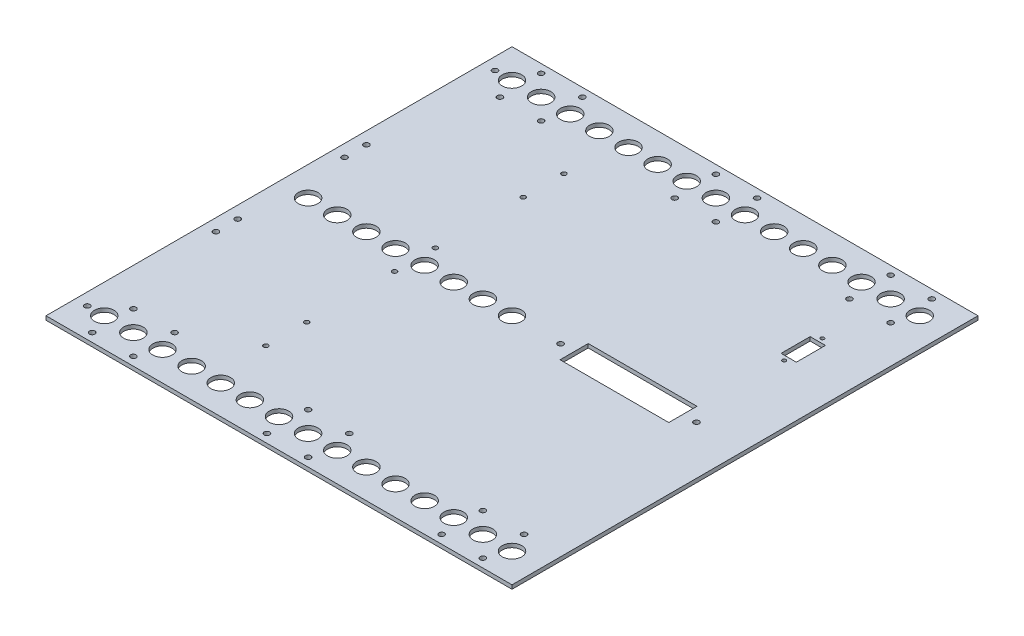
from build123d import *

# Parameters (mm, degrees)
SKETCH1_W           = 304.8
SKETCH1_H           = 304.8
SKETCH1_R           = 6.3627
SKETCH1_R_2         = 1.778
SKETCH1_R_3         = 1.524
SKETCH1_R_4         = 1.190625
SKETCH1_W_2         = 10.0000054
SKETCH1_H_2         = 18.9999874
SKETCH1_W_3         = 71.12
SKETCH1_H_3         = 18.415
BOSS_EXTRUDE1_DEPTH = 2.54


with BuildPart() as part:
    # Sketch1 → Boss-Extrude1 (new body)
    with BuildSketch(Plane(origin=(0, 0, 0), x_dir=(1, 0, 0), z_dir=(0, 1, 0))):
        Rectangle(SKETCH1_W, SKETCH1_H)
        with Locations(Location((-133.35, 133.35, 0), (0, 0, 270))):
            Circle(SKETCH1_R, mode=Mode.SUBTRACT)
        with Locations(Location((-114.3, 133.35, 0), (0, 0, 270))):
            Circle(SKETCH1_R, mode=Mode.SUBTRACT)
        with Locations(Location((-95.25, 133.35, 0), (0, 0, 270))):
            Circle(SKETCH1_R, mode=Mode.SUBTRACT)
        with Locations(Location((-76.2, 133.35, 0), (0, 0, 270))):
            Circle(SKETCH1_R, mode=Mode.SUBTRACT)
        with Locations(Location((-57.15, 133.35, 0), (0, 0, 270))):
            Circle(SKETCH1_R, mode=Mode.SUBTRACT)
        with Locations(Location((-38.1, 133.35, 0), (0, 0, 270))):
            Circle(SKETCH1_R, mode=Mode.SUBTRACT)
        with Locations(Location((-19.05, 133.35, 0), (0, 0, 270))):
            Circle(SKETCH1_R, mode=Mode.SUBTRACT)
        with Locations(Location((0, 133.35, 0), (0, 0, 270))):
            Circle(SKETCH1_R, mode=Mode.SUBTRACT)
        with Locations(Location((19.05, 133.35, 0), (0, 0, 270))):
            Circle(SKETCH1_R, mode=Mode.SUBTRACT)
        with Locations(Location((38.1, 133.35, 0), (0, 0, 270))):
            Circle(SKETCH1_R, mode=Mode.SUBTRACT)
        with Locations(Location((57.15, 133.35, 0), (0, 0, 270))):
            Circle(SKETCH1_R, mode=Mode.SUBTRACT)
        with Locations(Location((76.2, 133.35, 0), (0, 0, 270))):
            Circle(SKETCH1_R, mode=Mode.SUBTRACT)
        with Locations(Location((95.25, 133.35, 0), (0, 0, 270))):
            Circle(SKETCH1_R, mode=Mode.SUBTRACT)
        with Locations(Location((114.3, 133.35, 0), (0, 0, 270))):
            Circle(SKETCH1_R, mode=Mode.SUBTRACT)
        with Locations(Location((133.35, 133.35, 0), (0, 0, 270))):
            Circle(SKETCH1_R, mode=Mode.SUBTRACT)
        with Locations(Location((-114.3, 0, 0), (0, 0, 270))):
            Circle(SKETCH1_R, mode=Mode.SUBTRACT)
        with Locations(Location((-95.25, 0, 0), (0, 0, 270))):
            Circle(SKETCH1_R, mode=Mode.SUBTRACT)
        with Locations(Location((-76.2, 0, 0), (0, 0, 270))):
            Circle(SKETCH1_R, mode=Mode.SUBTRACT)
        with Locations(Location((-57.15, 0, 0), (0, 0, 270))):
            Circle(SKETCH1_R, mode=Mode.SUBTRACT)
        with Locations(Location((-38.1, 0, 0), (0, 0, 270))):
            Circle(SKETCH1_R, mode=Mode.SUBTRACT)
        with Locations(Location((-19.05, 0, 0), (0, 0, 270))):
            Circle(SKETCH1_R, mode=Mode.SUBTRACT)
        with Locations(Location((0, 0, 0), (0, 0, 270))):
            Circle(SKETCH1_R, mode=Mode.SUBTRACT)
        with Locations(Location((-127.770384182, 146.820384182, 0), (0, 0, 270))):
            Circle(SKETCH1_R_2, mode=Mode.SUBTRACT)
        with Locations(Location((-100.829615818, 146.820384182, 0), (0, 0, 270))):
            Circle(SKETCH1_R_2, mode=Mode.SUBTRACT)
        with Locations(Location((-100.829615818, 119.879615818, 0), (0, 0, 270))):
            Circle(SKETCH1_R_2, mode=Mode.SUBTRACT)
        with Locations(Location((-127.770384182, 119.879615818, 0), (0, 0, 270))):
            Circle(SKETCH1_R_2, mode=Mode.SUBTRACT)
        with Locations(Location((-13.470384182, 146.820384182, 0), (0, 0, 270))):
            Circle(SKETCH1_R_2, mode=Mode.SUBTRACT)
        with Locations(Location((13.470384182, 146.820384182, 0), (0, 0, 270))):
            Circle(SKETCH1_R_2, mode=Mode.SUBTRACT)
        with Locations(Location((-114.3, -133.35, 0), (0, 0, 270))):
            Circle(SKETCH1_R, mode=Mode.SUBTRACT)
        with Locations(Location((-95.25, -133.35, 0), (0, 0, 270))):
            Circle(SKETCH1_R, mode=Mode.SUBTRACT)
        with Locations(Location((-76.2, -133.35, 0), (0, 0, 270))):
            Circle(SKETCH1_R, mode=Mode.SUBTRACT)
        with Locations(Location((-57.15, -133.35, 0), (0, 0, 270))):
            Circle(SKETCH1_R, mode=Mode.SUBTRACT)
        with Locations(Location((-38.1, -133.35, 0), (0, 0, 270))):
            Circle(SKETCH1_R, mode=Mode.SUBTRACT)
        with Locations(Location((-19.05, -133.35, 0), (0, 0, 270))):
            Circle(SKETCH1_R, mode=Mode.SUBTRACT)
        with Locations(Location((0, -133.35, 0), (0, 0, 270))):
            Circle(SKETCH1_R, mode=Mode.SUBTRACT)
        with Locations(Location((19.05, -133.35, 0), (0, 0, 270))):
            Circle(SKETCH1_R, mode=Mode.SUBTRACT)
        with Locations(Location((38.1, -133.35, 0), (0, 0, 270))):
            Circle(SKETCH1_R, mode=Mode.SUBTRACT)
        with Locations(Location((57.15, -133.35, 0), (0, 0, 270))):
            Circle(SKETCH1_R, mode=Mode.SUBTRACT)
        with Locations(Location((76.2, -133.35, 0), (0, 0, 270))):
            Circle(SKETCH1_R, mode=Mode.SUBTRACT)
        with Locations(Location((95.25, -133.35, 0), (0, 0, 270))):
            Circle(SKETCH1_R, mode=Mode.SUBTRACT)
        with Locations(Location((114.3, -133.35, 0), (0, 0, 270))):
            Circle(SKETCH1_R, mode=Mode.SUBTRACT)
        with Locations(Location((133.35, -133.35, 0), (0, 0, 270))):
            Circle(SKETCH1_R, mode=Mode.SUBTRACT)
        with Locations(Location((-133.35, 0, 0), (0, 0, 270))):
            Circle(SKETCH1_R, mode=Mode.SUBTRACT)
        with Locations(Location((-133.35, -133.35, 0), (0, 0, 270))):
            Circle(SKETCH1_R, mode=Mode.SUBTRACT)
        with Locations(Location((13.470384182, 119.879615818, 0), (0, 0, 270))):
            Circle(SKETCH1_R_2, mode=Mode.SUBTRACT)
        with Locations(Location((-13.470384182, 119.879615818, 0), (0, 0, 270))):
            Circle(SKETCH1_R_2, mode=Mode.SUBTRACT)
        with Locations(Location((127.770384182, 146.820384182, 0), (0, 0, 270))):
            Circle(SKETCH1_R_2, mode=Mode.SUBTRACT)
        with Locations(Location((127.770384182, 119.879615818, 0), (0, 0, 270))):
            Circle(SKETCH1_R_2, mode=Mode.SUBTRACT)
        with Locations(Location((100.829615818, 119.879615818, 0), (0, 0, 270))):
            Circle(SKETCH1_R_2, mode=Mode.SUBTRACT)
        with Locations(Location((100.829615818, 146.820384182, 0), (0, 0, 270))):
            Circle(SKETCH1_R_2, mode=Mode.SUBTRACT)
        with Locations(Location((127.770384182, -119.879615818, 0), (0, 0, 270))):
            Circle(SKETCH1_R_2, mode=Mode.SUBTRACT)
        with Locations(Location((127.770384182, -146.820384182, 0), (0, 0, 270))):
            Circle(SKETCH1_R_2, mode=Mode.SUBTRACT)
        with Locations(Location((100.829615818, -146.820384182, 0), (0, 0, 270))):
            Circle(SKETCH1_R_2, mode=Mode.SUBTRACT)
        with Locations(Location((100.829615818, -119.879615818, 0), (0, 0, 270))):
            Circle(SKETCH1_R_2, mode=Mode.SUBTRACT)
        with Locations(Location((13.470384182, -119.879615818, 0), (0, 0, 270))):
            Circle(SKETCH1_R_2, mode=Mode.SUBTRACT)
        with Locations(Location((13.470384182, -146.820384182, 0), (0, 0, 270))):
            Circle(SKETCH1_R_2, mode=Mode.SUBTRACT)
        with Locations(Location((-13.470384182, -146.820384182, 0), (0, 0, 270))):
            Circle(SKETCH1_R_2, mode=Mode.SUBTRACT)
        with Locations(Location((-13.470384182, -119.879615818, 0), (0, 0, 270))):
            Circle(SKETCH1_R_2, mode=Mode.SUBTRACT)
        with Locations(Location((-127.770384182, -119.879615818, 0), (0, 0, 270))):
            Circle(SKETCH1_R_2, mode=Mode.SUBTRACT)
        with Locations(Location((-127.770384182, -146.820384182, 0), (0, 0, 270))):
            Circle(SKETCH1_R_2, mode=Mode.SUBTRACT)
        with Locations(Location((-100.829615818, -146.820384182, 0), (0, 0, 270))):
            Circle(SKETCH1_R_2, mode=Mode.SUBTRACT)
        with Locations(Location((-100.829615818, -119.879615818, 0), (0, 0, 270))):
            Circle(SKETCH1_R_2, mode=Mode.SUBTRACT)
        with Locations(Location((-63.5, 97.4725, 0), (0, 0, 270))):
            Circle(SKETCH1_R_3, mode=Mode.SUBTRACT)
        with Locations(Location((-63.5, 70.8025, 0), (0, 0, 270))):
            Circle(SKETCH1_R_3, mode=Mode.SUBTRACT)
        with Locations(Location((-144.4625, 133.35, 0), (0, 0, 270))):
            Circle(SKETCH1_R_2, mode=Mode.SUBTRACT)
        with Locations(Location((-144.4625, 34.925, 0), (0, 0, 270))):
            Circle(SKETCH1_R_2, mode=Mode.SUBTRACT)
        with Locations(Location((-63.5, 13.335, 0), (0, 0, 270))):
            Circle(SKETCH1_R_3, mode=Mode.SUBTRACT)
        with Locations(Location((-63.5, -13.335, 0), (0, 0, 270))):
            Circle(SKETCH1_R_3, mode=Mode.SUBTRACT)
        with Locations(Location((-144.4625, 49.2125, 0), (0, 0, 270))):
            Circle(SKETCH1_R_2, mode=Mode.SUBTRACT)
        with Locations(Location((-144.4625, -49.2125, 0), (0, 0, 270))):
            Circle(SKETCH1_R_2, mode=Mode.SUBTRACT)
        with Locations(Location((-63.5, -70.8025, 0), (0, 0, 270))):
            Circle(SKETCH1_R_3, mode=Mode.SUBTRACT)
        with Locations(Location((-63.5, -97.4725, 0), (0, 0, 270))):
            Circle(SKETCH1_R_3, mode=Mode.SUBTRACT)
        with Locations(Location((-144.4625, -34.925, 0), (0, 0, 270))):
            Circle(SKETCH1_R_2, mode=Mode.SUBTRACT)
        with Locations(Location((-144.4625, -133.35, 0), (0, 0, 270))):
            Circle(SKETCH1_R_2, mode=Mode.SUBTRACT)
        with Locations(Location((114.3, 88.7000004, 0), (0, 0, 270))):
            Circle(SKETCH1_R_4, mode=Mode.SUBTRACT)
        with Locations(Location((114.3, 63.6999996, 0), (0, 0, 270))):
            Circle(SKETCH1_R_4, mode=Mode.SUBTRACT)
        with Locations(Location((31.73843479, 0, 0), (0, 0, 270))):
            Circle(SKETCH1_R_2, mode=Mode.SUBTRACT)
        with Locations(Location((120.66156521, 0, 0), (0, 0, 270))):
            Circle(SKETCH1_R_2, mode=Mode.SUBTRACT)
        with Locations((114.3, 76.2)):
            Rectangle(SKETCH1_W_2, SKETCH1_H_2, mode=Mode.SUBTRACT)
        with Locations((76.2, 0)):
            Rectangle(SKETCH1_W_3, SKETCH1_H_3, mode=Mode.SUBTRACT)
    extrude(amount=BOSS_EXTRUDE1_DEPTH)


solid = part.part
